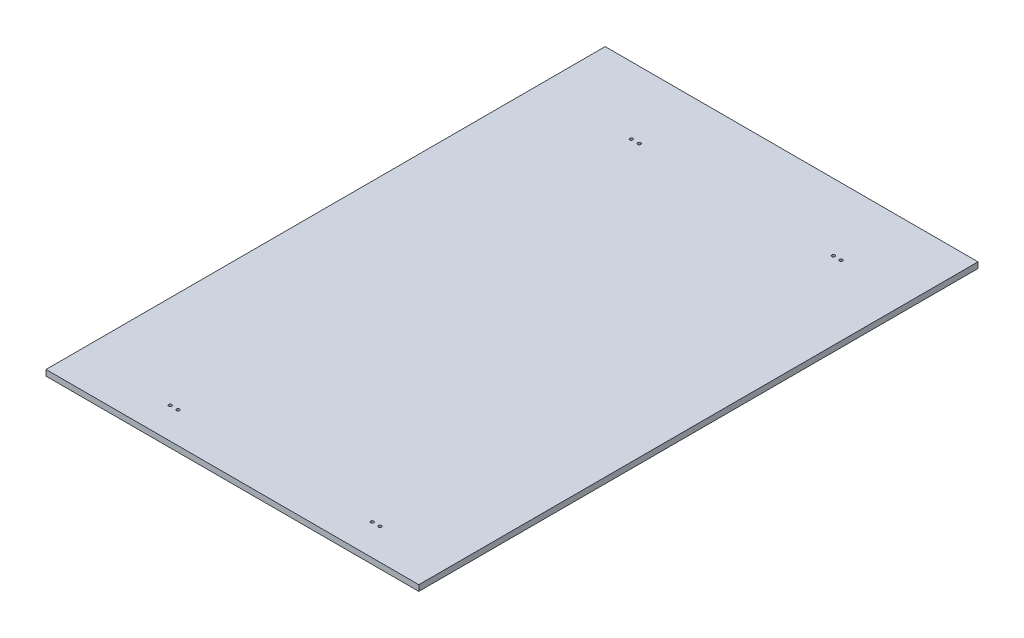
from build123d import *

# Parameters (mm, degrees)
SKETCH1_W               = 1219.2
SKETCH1_H               = 1828.8
BOSS_EXTRUDE1_DEPTH     = 19.05
F_3_8_CLEARANCE_HOLE1_D = 10.0838


with BuildPart() as part:
    # Sketch1 → Boss-Extrude1 (new body)
    with BuildSketch(Plane(origin=(0, 0, 0), x_dir=(1, 0, 0), z_dir=(0, 1, 0))):
        Rectangle(SKETCH1_W, SKETCH1_H)
    extrude(amount=BOSS_EXTRUDE1_DEPTH)

    # 3/8 Clearance Hole1 (through all)
    with Locations(Plane(origin=(0, 19.05, 0), x_dir=(1, 0, 0), z_dir=(0, 1, 0))):
        with Locations((-304.8, 695.2996), (381, -812.8), (-304.8, -812.8), (381, 695.2996), (355.6, -812.8), (-279.4, -812.8), (-279.4, 695.2996), (355.6, 695.2996)):
            Hole(F_3_8_CLEARANCE_HOLE1_D / 2)


solid = part.part
